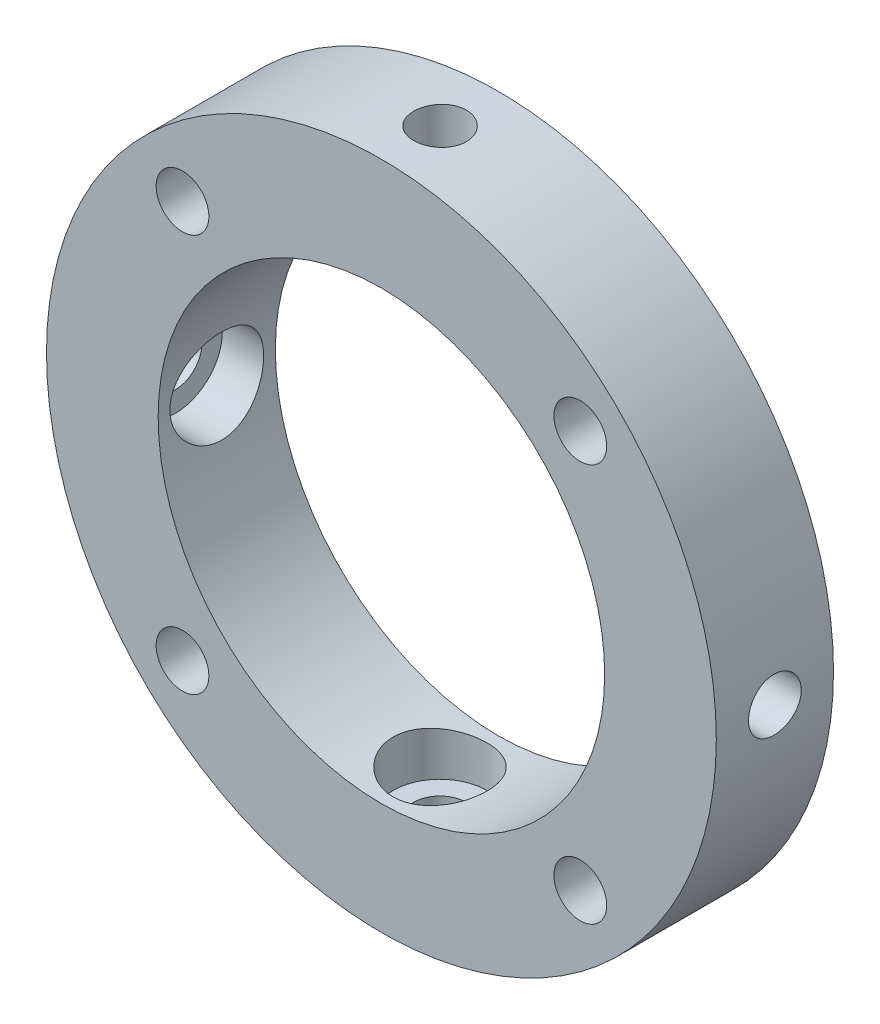
from build123d import *

# Parameters (mm, degrees)
SKETCH1_R           = 28.575
BOSS_EXTRUDE1_DEPTH = 10
SKETCH2_R           = 19.05
CUT_EXTRUDE1_DEPTH  = 42.630052246
SKETCH5_R           = 2.25
CUT_EXTRUDE2_DEPTH  = 65.673434461
SKETCH6_R           = 2.25
CUT_EXTRUDE3_DEPTH  = 42.630052408
CUT_EXTRUDE5_START  = -6
SKETCH7_R           = 4
SKETCH7_R_2         = 2.25
CUT_EXTRUDE5_DEPTH  = 4
CUT_EXTRUDE6_START  = -47.15
SKETCH7_4_R         = 4
SKETCH7_4_R_2       = 2.25
CUT_EXTRUDE6_DEPTH  = 4
CIRPATTERN6_COUNT   = 2
CIRPATTERN6_ANGLE   = 90


with BuildPart() as part:
    # Sketch1 → Boss-Extrude1 (new body)
    with BuildSketch(Plane.XY):
        Circle(SKETCH1_R)
    extrude(amount=BOSS_EXTRUDE1_DEPTH)

    # Sketch2 → Cut-Extrude1 (cut, through all)
    with BuildSketch(Plane.XY.offset(10)):
        Circle(SKETCH2_R)
    extrude(amount=-CUT_EXTRUDE1_DEPTH, mode=Mode.SUBTRACT)

    # Sketch5 → Cut-Extrude2 (cut, through all)
    with BuildSketch(Plane(origin=(0, 28.575, 0), x_dir=(1, 0, 0), z_dir=(0, 1, 0))):
        with Locations(Location((0, -5, 0), (0, 0, 270))):
            Circle(SKETCH5_R)
    cut_extrude2 = extrude(amount=-CUT_EXTRUDE2_DEPTH, mode=Mode.SUBTRACT)

    # Sketch6 → Cut-Extrude3 (cut, through all)
    with BuildSketch(Plane.XY.offset(10)):
        with Locations((-16.970562748, 16.970562748)):
            Circle(SKETCH6_R)
        with Locations((16.970562748, 16.970562748)):
            Circle(SKETCH6_R)
        with Locations((16.970562748, -16.970562748)):
            Circle(SKETCH6_R)
        with Locations((-16.970562748, -16.970562748)):
            Circle(SKETCH6_R)
    extrude(amount=-CUT_EXTRUDE3_DEPTH, mode=Mode.SUBTRACT)

    # Sketch7 → Cut-Extrude5 (cut)
    with BuildSketch(Plane(origin=(0, 28.575, 0), x_dir=(1, 0, 0), z_dir=(0, 1, 0)).offset(CUT_EXTRUDE5_START)):
        with Locations(Location((0, -5, 0), (0, 0, 90))):
            Circle(SKETCH7_R)
        with Locations(Location((0, -5, 0), (0, 0, 270))):
            Circle(SKETCH7_R_2, mode=Mode.SUBTRACT)
    cut_extrude5 = extrude(amount=-CUT_EXTRUDE5_DEPTH, mode=Mode.SUBTRACT)

    # Sketch7<4> → Cut-Extrude6 (cut)
    with BuildSketch(Plane(origin=(0, 28.575, 0), x_dir=(1, 0, 0), z_dir=(0, 1, 0)).offset(CUT_EXTRUDE6_START)):
        with Locations(Location((0, -5, 0), (0, 0, 90))):
            Circle(SKETCH7_4_R)
        with Locations(Location((0, -5, 0), (0, 0, 270))):
            Circle(SKETCH7_4_R_2, mode=Mode.SUBTRACT)
    cut_extrude6 = extrude(amount=-CUT_EXTRUDE6_DEPTH, mode=Mode.SUBTRACT)

    # CirPattern6: Cut-Extrude2, Cut-Extrude5, Cut-Extrude6 ×2 about axis
    cirpattern6_axis = Axis((0, 0, 10), (0, 0, 1))
    add([cut_extrude2.rotate(cirpattern6_axis, i * CIRPATTERN6_ANGLE / (CIRPATTERN6_COUNT - 1)) for i in range(1, CIRPATTERN6_COUNT)], mode=Mode.SUBTRACT)
    add([cut_extrude5.rotate(cirpattern6_axis, i * CIRPATTERN6_ANGLE / (CIRPATTERN6_COUNT - 1)) for i in range(1, CIRPATTERN6_COUNT)], mode=Mode.SUBTRACT)
    add([cut_extrude6.rotate(cirpattern6_axis, i * CIRPATTERN6_ANGLE / (CIRPATTERN6_COUNT - 1)) for i in range(1, CIRPATTERN6_COUNT)], mode=Mode.SUBTRACT)


solid = part.part
